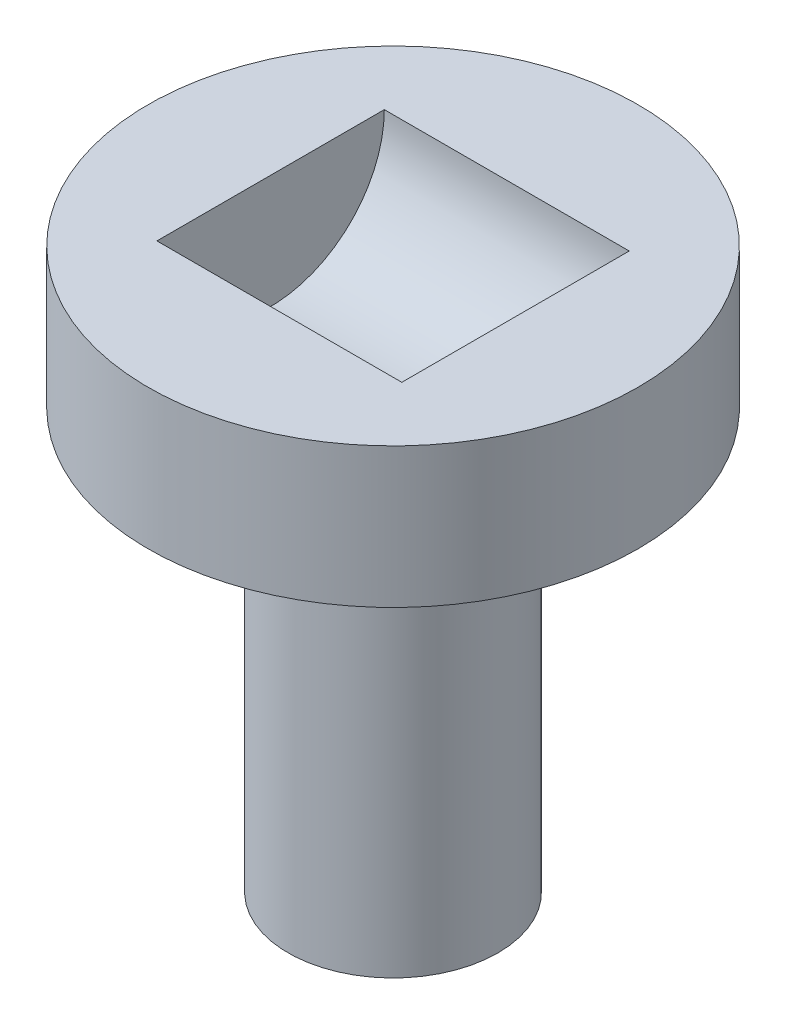
from build123d import *

# Parameters (mm, degrees)
SKETCH_2_R          = 3.25
CUT_EXTRUDE_1_DEPTH = 3.5


with BuildPart() as part:
    # 草图1 → 旋转1 (revolve)
    with BuildSketch(Plane.XY):
        with BuildLine():
            Line((0, 8), (7, 8))
            Line((7, 8), (7, 4))
            Line((7, 4), (5, 4))
            ThreePointArc((5, 4), (3.585786438, 3.414213562), (3, 2))
            Line((3, 2), (3, -8))
            Line((3, -8), (1.22, -8))
            Line((1.22, -8), (1.22, 0))
            Line((1.22, 0), (0, 0))
            Line((0, 0), (0, 8))
        make_face()
    revolve(axis=Axis((0, -147.558866066, 0), (0, 1, 0)))

    # 草图2 → 切除-拉伸1 (cut, symmetric)
    with BuildSketch(Plane(origin=(0, 0, 0), x_dir=(0, 0, -1), z_dir=(1, 0, 0))):
        with Locations((0, 8)):
            Circle(SKETCH_2_R)
    extrude(amount=CUT_EXTRUDE_1_DEPTH, both=True, mode=Mode.SUBTRACT)


solid = part.part
